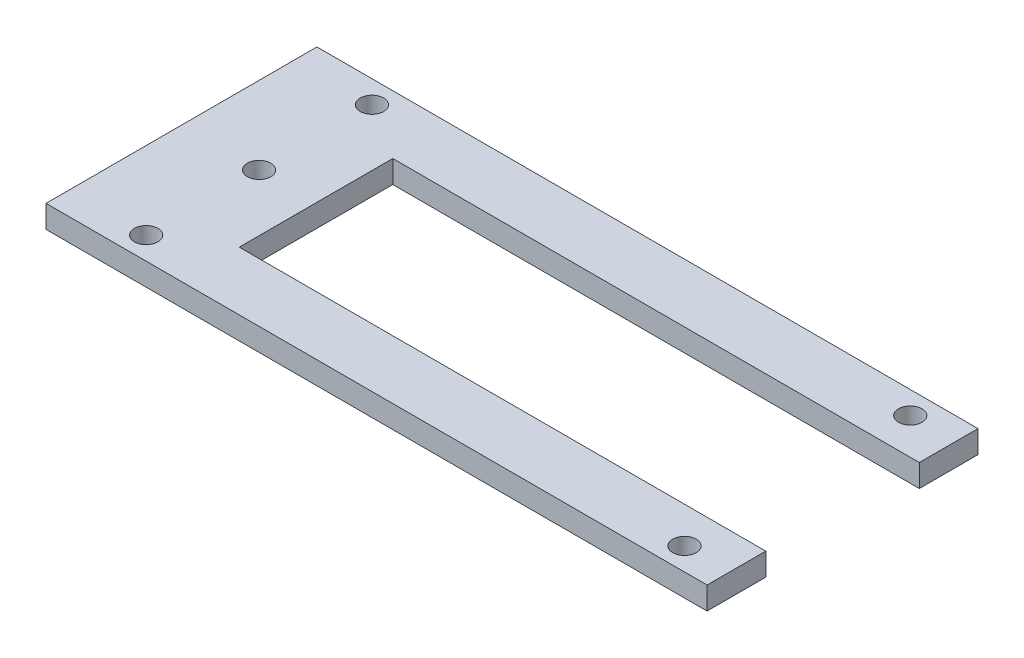
from build123d import *

# Parameters (mm, degrees)
SKETCH1_W           = 92.964
SKETCH1_H           = 38.1
SKETCH1_R           = 1.651
BOSS_EXTRUDE1_DEPTH = 3.175
SKETCH2_W           = 74.041
SKETCH2_H           = 21.59
CUT_EXTRUDE1_DEPTH  = 3.175


with BuildPart() as part:
    # Sketch1 → Boss-Extrude1 (new body)
    with BuildSketch(Plane(origin=(0, 0, 0), x_dir=(1, 0, 0), z_dir=(0, 1, 0))):
        Rectangle(SKETCH1_W, SKETCH1_H)
        with Locations(Location((-35.567692741, -15.875, 0), (0, 0, 270))):
            Circle(SKETCH1_R, mode=Mode.SUBTRACT)
        with Locations(Location((-35.567692741, 15.875, 0), (0, 0, 270))):
            Circle(SKETCH1_R, mode=Mode.SUBTRACT)
        with Locations(Location((40.132, 15.875, 0), (0, 0, 270))):
            Circle(SKETCH1_R, mode=Mode.SUBTRACT)
        with Locations(Location((40.132, -15.875, 0), (0, 0, 270))):
            Circle(SKETCH1_R, mode=Mode.SUBTRACT)
        with Locations(Location((-35.567692741, 0, 0), (0, 0, 270))):
            Circle(SKETCH1_R, mode=Mode.SUBTRACT)
    extrude(amount=BOSS_EXTRUDE1_DEPTH)

    # Sketch2 → Cut-Extrude1 (cut)
    with BuildSketch(Plane(origin=(0, 3.175, 0), x_dir=(1, 0, 0), z_dir=(0, 1, 0))):
        with Locations((9.4615, 0)):
            Rectangle(SKETCH2_W, SKETCH2_H)
    extrude(amount=-CUT_EXTRUDE1_DEPTH, mode=Mode.SUBTRACT)


solid = part.part
